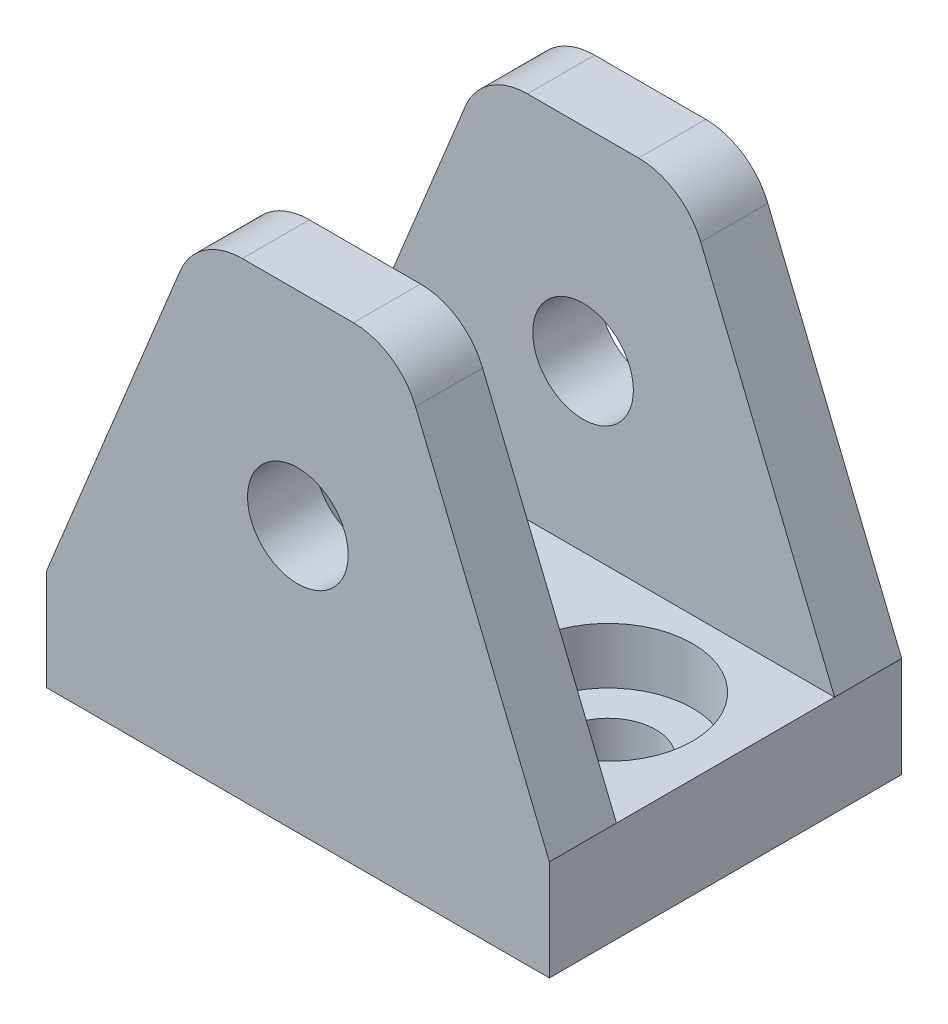
from build123d import *

# Parameters (mm, degrees)
SKETCH1_W                               = 47.625
SKETCH1_H                               = 33.3502
BOSS_EXTRUDE1_DEPTH                     = 44.45
SKETCH2_W                               = 47.625
SKETCH2_H                               = 20.6502
CUT_EXTRUDE1_DEPTH                      = 34.925
CUT_EXTRUDE2_DEPTH                      = 61.457203841
CUT_EXTRUDE2_DEPTH_BACK                 = 61.457203841
CBORE_FOR_M8_HEX_HEAD_BOLT1_D           = 9
CBORE_FOR_M8_HEX_HEAD_BOLT1_DEPTH       = 13.298127214
CBORE_FOR_M8_HEX_HEAD_BOLT1_CBORE_D     = 16
CBORE_FOR_M8_HEX_HEAD_BOLT1_CBORE_DEPTH = 5.3
CBORE_FOR_M8_HEX_HEAD_BOLT1_TIP         = 2.703872786
FILLET3_R                               = 6.35
F_3_8_0_375_DIAMETER_HOLE1_D            = 9.525


with BuildPart() as part:
    # Sketch1 → Boss-Extrude1 (new body)
    with BuildSketch(Plane(origin=(0, 0, 0), x_dir=(1, 0, 0), z_dir=(0, 1, 0))):
        Rectangle(SKETCH1_W, SKETCH1_H)
    extrude(amount=BOSS_EXTRUDE1_DEPTH)

    # Sketch2 → Cut-Extrude1 (cut)
    with BuildSketch(Plane(origin=(0, 44.45, 0), x_dir=(1, 0, 0), z_dir=(0, 1, 0))):
        Rectangle(SKETCH2_W, SKETCH2_H)
    extrude(amount=-CUT_EXTRUDE1_DEPTH, mode=Mode.SUBTRACT)

    # Sketch3 → Cut-Extrude2 (cut, two sides: drawn at the far end of the back side and taken through both)
    with BuildSketch(Plane(origin=(0, 0, -16.6751), x_dir=(-1, 0, 0), z_dir=(0, 0, -1)).offset(-CUT_EXTRUDE2_DEPTH_BACK)):
        Polygon((23.8125, 44.45), (9.525, 44.45), (23.8125, 9.525), align=None)
        Polygon((-23.8125, 9.525), (-9.525, 44.45), (-23.8125, 44.45), align=None)
    extrude(amount=CUT_EXTRUDE2_DEPTH + CUT_EXTRUDE2_DEPTH_BACK, mode=Mode.SUBTRACT)

    # CBORE for M8 Hex Head Bolt1
    with Locations(Plane(origin=(0, 9.525, 0), x_dir=(1, 0, 0), z_dir=(0, 1, 0))):
        with Locations((-12.7, 0), (12.7, 0)):
            CounterBoreHole(CBORE_FOR_M8_HEX_HEAD_BOLT1_D / 2, CBORE_FOR_M8_HEX_HEAD_BOLT1_CBORE_D / 2, CBORE_FOR_M8_HEX_HEAD_BOLT1_CBORE_DEPTH, depth=CBORE_FOR_M8_HEX_HEAD_BOLT1_DEPTH)
            with Locations((0, 0, -(CBORE_FOR_M8_HEX_HEAD_BOLT1_DEPTH + CBORE_FOR_M8_HEX_HEAD_BOLT1_TIP / 2))):  # 118° drill point
                Cone(0, CBORE_FOR_M8_HEX_HEAD_BOLT1_D / 2, CBORE_FOR_M8_HEX_HEAD_BOLT1_TIP, mode=Mode.SUBTRACT)

    # Fillet3
    fillet3_edges = [part.edges().sort_by_distance(p)[0] for p in [
        (9.525, 44.45, 13.5001),
        (-9.525, 44.45, 13.5001),
        (9.525, 44.45, -13.5001),
        (-9.525, 44.45, -13.5001),
    ]]
    fillet(fillet3_edges, radius=FILLET3_R)

    # 3/8 (0.375) Diameter Hole1 (through all)
    with Locations(Plane.XY.offset(16.6751)):
        with Locations((0, 25.161662577)):
            Hole(F_3_8_0_375_DIAMETER_HOLE1_D / 2)


solid = part.part
